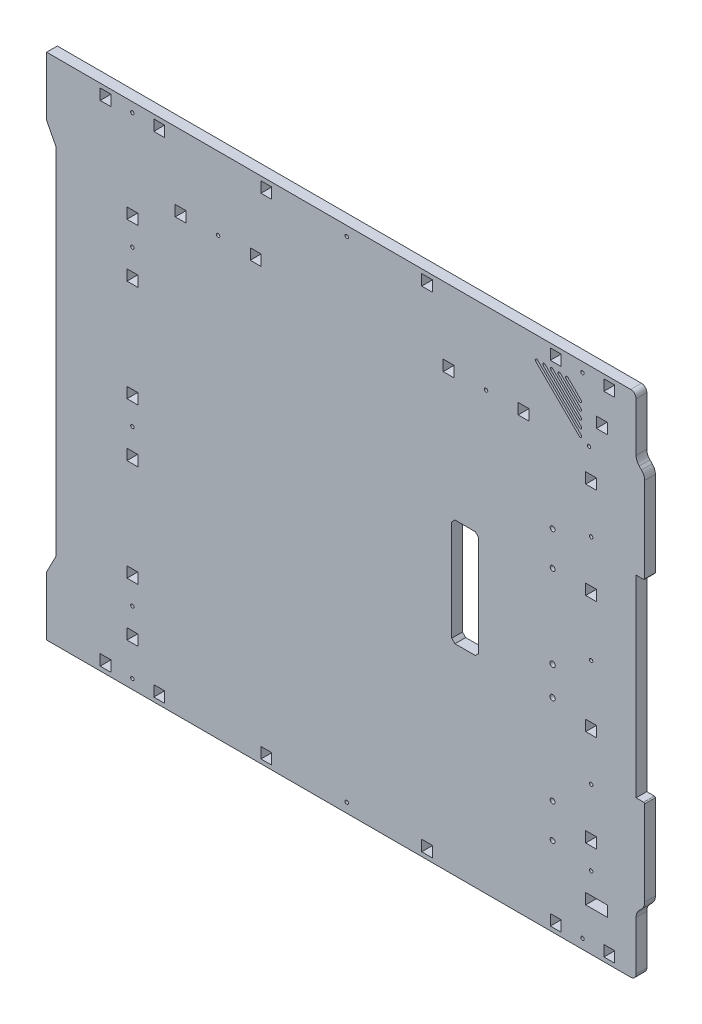
from build123d import *

# Parameters (mm, degrees)
SKETCH_1_R      = 2.5
SKETCH_1_R_2    = 2.25
SKETCH_1_R_3    = 1.6
SKETCH_1_W      = 10.1
SKETCH_1_H      = 10
SKETCH_1_W_2    = 10
SKETCH_1_H_2    = 10.1
SKETCH_1_W_3    = 20.1
EXTRUDE_1_DEPTH = 10


with BuildPart() as part:
    # Эскиз1 → Бобышка-Вытянуть1 (new body)
    with BuildSketch(Plane.XY):
        with BuildLine():
            Line((-279, 237.5), (266, 237.5))
            ThreePointArc((266, 237.5), (269.535533906, 236.035533906), (271, 232.5))
            Line((271, 232.5), (271, 186.642146))
            ThreePointArc((271, 186.642146), (271.761204648, 182.815304078), (273.928935881, 179.571064119))
            Line((273.928935881, 179.571064119), (276.071067811, 177.428932189))
            ThreePointArc((276.071067811, 177.428932189), (278.238795325, 174.1846987), (279, 170.357864375))
            Line((279, 170.357864375), (279, 91.000000001))
            ThreePointArc((279, 91.000000001), (278.707106781, 90.292893219), (277.999999999, 90))
            Line((277.999999999, 90), (271, 90))
            Line((271, 90), (271, -90))
            Line((271, -90), (278, -90))
            ThreePointArc((278, -90), (278.707106781, -90.292893219), (279, -91))
            Line((279, -91), (279, -170.357864376))
            ThreePointArc((279, -170.357864376), (278.238795325, -174.1846987), (276.071067812, -177.428932188))
            Line((276.071067812, -177.428932188), (273.928932188, -179.571067812))
            ThreePointArc((273.928932188, -179.571067812), (271.761204603, -182.815301474), (271, -186.642136))
            Line((271, -186.642136), (271, -232.5))
            ThreePointArc((271, -232.5), (269.535533906, -236.035533906), (266, -237.5))
            Line((266, -237.5), (-279, -237.5))
            Line((-279, -237.5), (-279, -182.5))
            Line((-279, -182.5), (-270.269743, -165.5))
            Line((-270.269743, -165.5), (-270.269743, 165.5))
            Line((-270.269743, 165.5), (-279, 182.5))
            Line((-279, 182.5), (-279, 237.5))
        make_face()
        with Locations(Location((193.097675, -48, 0), (0, 0, 180))):
            Circle(SKETCH_1_R, mode=Mode.SUBTRACT)
        with Locations(Location((193.097675, -21, 0), (0, 0, 180))):
            Circle(SKETCH_1_R, mode=Mode.SUBTRACT)
        with Locations(Location((193.097675, -131.5, 0), (0, 0, 180))):
            Circle(SKETCH_1_R_2, mode=Mode.SUBTRACT)
        with Locations(Location((193.097675, 56.5, 0), (0, 0, 180))):
            Circle(SKETCH_1_R_2, mode=Mode.SUBTRACT)
        with Locations(Location((193.097675, 88.5, 0), (0, 0, 180))):
            Circle(SKETCH_1_R_2, mode=Mode.SUBTRACT)
        with Locations(Location((193.097675, -163.5, 0), (0, 0, 180))):
            Circle(SKETCH_1_R_2, mode=Mode.SUBTRACT)
        with Locations(Location((-198.952324998, -25, 0), (0, 0, 180))):
            Circle(SKETCH_1_R_3, mode=Mode.SUBTRACT)
        with Locations(Location((-119, 169.449999998, 0), (0, 0, 180))):
            Circle(SKETCH_1_R_3, mode=Mode.SUBTRACT)
        with Locations(Location((131, 169.449999998, 0), (0, 0, 180))):
            Circle(SKETCH_1_R_3, mode=Mode.SUBTRACT)
        with Locations(Location((229.050000003, 0, 0), (0, 0, 180))):
            Circle(SKETCH_1_R_3, mode=Mode.SUBTRACT)
        with Locations(Location((-198.952324998, 120, 0), (0, 0, 180))):
            Circle(SKETCH_1_R_3, mode=Mode.SUBTRACT)
        with Locations(Location((-198.952324998, -170, 0), (0, 0, 180))):
            Circle(SKETCH_1_R_3, mode=Mode.SUBTRACT)
        with Locations(Location((229.050000003, -170, 0), (0, 0, 180))):
            Circle(SKETCH_1_R_3, mode=Mode.SUBTRACT)
        with Locations(Location((221, -228.550000004, 0), (0, 0, 180))):
            Circle(SKETCH_1_R_3, mode=Mode.SUBTRACT)
        with Locations(Location((-199, 228.549999996, 0), (0, 0, 180))):
            Circle(SKETCH_1_R_3, mode=Mode.SUBTRACT)
        with Locations(Location((1, 228.549999996, 0), (0, 0, 180))):
            Circle(SKETCH_1_R_3, mode=Mode.SUBTRACT)
        with Locations(Location((221, 228.549999996, 0), (0, 0, 180))):
            Circle(SKETCH_1_R_3, mode=Mode.SUBTRACT)
        with Locations(Location((227.050000002, 171.999999998, 0), (0, 0, 180))):
            Circle(SKETCH_1_R_3, mode=Mode.SUBTRACT)
        with Locations(Location((229.050000003, -100, 0), (0, 0, 180))):
            Circle(SKETCH_1_R_3, mode=Mode.SUBTRACT)
        with Locations(Location((1, -228.550000004, 0), (0, 0, 180))):
            Circle(SKETCH_1_R_3, mode=Mode.SUBTRACT)
        with Locations(Location((-199, -228.550000004, 0), (0, 0, 180))):
            Circle(SKETCH_1_R_3, mode=Mode.SUBTRACT)
        with Locations(Location((229.050000003, 100, 0), (0, 0, 180))):
            Circle(SKETCH_1_R_3, mode=Mode.SUBTRACT)
        Polygon((124, -47), (121, -50), (102, -50), (99, -47), (99, 47), (102, 50), (121, 50), (124, 47), align=None, mode=Mode.SUBTRACT)
        with Locations((-198.952325, -50)):
            Rectangle(SKETCH_1_W, SKETCH_1_H, mode=Mode.SUBTRACT)
        with Locations((-198.952325, 0)):
            Rectangle(SKETCH_1_W, SKETCH_1_H, mode=Mode.SUBTRACT)
        with Locations((-84, 169.45)):
            Rectangle(SKETCH_1_W_2, SKETCH_1_H_2, mode=Mode.SUBTRACT)
        with Locations((96, 169.45)):
            Rectangle(SKETCH_1_W_2, SKETCH_1_H_2, mode=Mode.SUBTRACT)
        with Locations((-154, 169.45)):
            Rectangle(SKETCH_1_W_2, SKETCH_1_H_2, mode=Mode.SUBTRACT)
        with Locations((166, 169.45)):
            Rectangle(SKETCH_1_W_2, SKETCH_1_H_2, mode=Mode.SUBTRACT)
        with BuildLine():
            Line((218.14655, 175.561014), (177.263901, 215.994403))
            ThreePointArc((177.263901, 215.994403), (177.254134, 217.762143), (179.021874, 217.77191))
            Line((179.021874, 217.77191), (219.904524, 177.33852))
            ThreePointArc((219.904524, 177.33852), (219.91429, 175.57078), (218.14655, 175.561014))
        make_face(mode=Mode.SUBTRACT)
        with BuildLine():
            Line((217.990286, 203.844853), (205.547741, 216.150668))
            ThreePointArc((205.547741, 216.150668), (205.5379745, 217.9184075), (207.305714, 217.928174))
            Line((207.305714, 217.928174), (219.748259, 205.62236))
            ThreePointArc((219.748259, 205.62236), (219.758026, 203.85462), (217.990286, 203.844853))
        make_face(mode=Mode.SUBTRACT)
        with BuildLine():
            Line((218.107484, 182.631974), (184.334861, 216.033469))
            ThreePointArc((184.334861, 216.033469), (184.325094, 217.801209), (186.092834, 217.810976))
            Line((186.092834, 217.810976), (219.865458, 184.40948))
            ThreePointArc((219.865458, 184.40948), (219.875224, 182.64174), (218.107484, 182.631974))
        make_face(mode=Mode.SUBTRACT)
        with BuildLine():
            Line((218.068418, 189.702934), (191.405821, 216.072535))
            ThreePointArc((191.405821, 216.072535), (191.396054, 217.840275), (193.163794, 217.850042))
            Line((193.163794, 217.850042), (219.826392, 191.48044))
            ThreePointArc((219.826392, 191.48044), (219.836158, 189.7127), (218.068418, 189.702934))
        make_face(mode=Mode.SUBTRACT)
        with BuildLine():
            Line((218.029352, 196.773894), (198.476781, 216.111602))
            ThreePointArc((198.476781, 216.111602), (198.4670145, 217.8793415), (200.234754, 217.889108))
            Line((200.234754, 217.889108), (219.787326, 198.5514))
            ThreePointArc((219.787326, 198.5514), (219.797092, 196.78366), (218.029352, 196.773894))
        make_face(mode=Mode.SUBTRACT)
        with Locations((229.05, -55)):
            Rectangle(SKETCH_1_W, SKETCH_1_H, mode=Mode.SUBTRACT)
        with Locations((229.05, -145)):
            Rectangle(SKETCH_1_W, SKETCH_1_H, mode=Mode.SUBTRACT)
        with Locations((239.05, 195)):
            Rectangle(SKETCH_1_W, SKETCH_1_H, mode=Mode.SUBTRACT)
        with Locations((229.05, 55)):
            Rectangle(SKETCH_1_W, SKETCH_1_H, mode=Mode.SUBTRACT)
        with Locations((234.05, -195)):
            Rectangle(SKETCH_1_W_3, SKETCH_1_H, mode=Mode.SUBTRACT)
        with Locations((229.05, 145)):
            Rectangle(SKETCH_1_W, SKETCH_1_H, mode=Mode.SUBTRACT)
        with Locations((-174, -228.55)):
            Rectangle(SKETCH_1_W_2, SKETCH_1_H_2, mode=Mode.SUBTRACT)
        with Locations((-174, 228.55)):
            Rectangle(SKETCH_1_W_2, SKETCH_1_H_2, mode=Mode.SUBTRACT)
        with Locations((196, -228.55)):
            Rectangle(SKETCH_1_W_2, SKETCH_1_H_2, mode=Mode.SUBTRACT)
        with Locations((196, 228.55)):
            Rectangle(SKETCH_1_W_2, SKETCH_1_H_2, mode=Mode.SUBTRACT)
        with Locations((246, -228.55)):
            Rectangle(SKETCH_1_W_2, SKETCH_1_H_2, mode=Mode.SUBTRACT)
        with Locations((246, 228.55)):
            Rectangle(SKETCH_1_W_2, SKETCH_1_H_2, mode=Mode.SUBTRACT)
        with Locations((-74, -228.55)):
            Rectangle(SKETCH_1_W_2, SKETCH_1_H_2, mode=Mode.SUBTRACT)
        with Locations((-74, 228.55)):
            Rectangle(SKETCH_1_W_2, SKETCH_1_H_2, mode=Mode.SUBTRACT)
        with Locations((-224, 228.55)):
            Rectangle(SKETCH_1_W_2, SKETCH_1_H_2, mode=Mode.SUBTRACT)
        with Locations((-224, -228.55)):
            Rectangle(SKETCH_1_W_2, SKETCH_1_H_2, mode=Mode.SUBTRACT)
        with Locations((76, -228.55)):
            Rectangle(SKETCH_1_W_2, SKETCH_1_H_2, mode=Mode.SUBTRACT)
        with Locations((76, 228.55)):
            Rectangle(SKETCH_1_W_2, SKETCH_1_H_2, mode=Mode.SUBTRACT)
        with Locations((-198.952325, -195)):
            Rectangle(SKETCH_1_W, SKETCH_1_H, mode=Mode.SUBTRACT)
        with Locations((-198.952325, -145)):
            Rectangle(SKETCH_1_W, SKETCH_1_H, mode=Mode.SUBTRACT)
        with Locations((-198.952325, 95)):
            Rectangle(SKETCH_1_W, SKETCH_1_H, mode=Mode.SUBTRACT)
        with Locations((-198.952325, 145)):
            Rectangle(SKETCH_1_W, SKETCH_1_H, mode=Mode.SUBTRACT)
    extrude(amount=EXTRUDE_1_DEPTH)


solid = part.part
